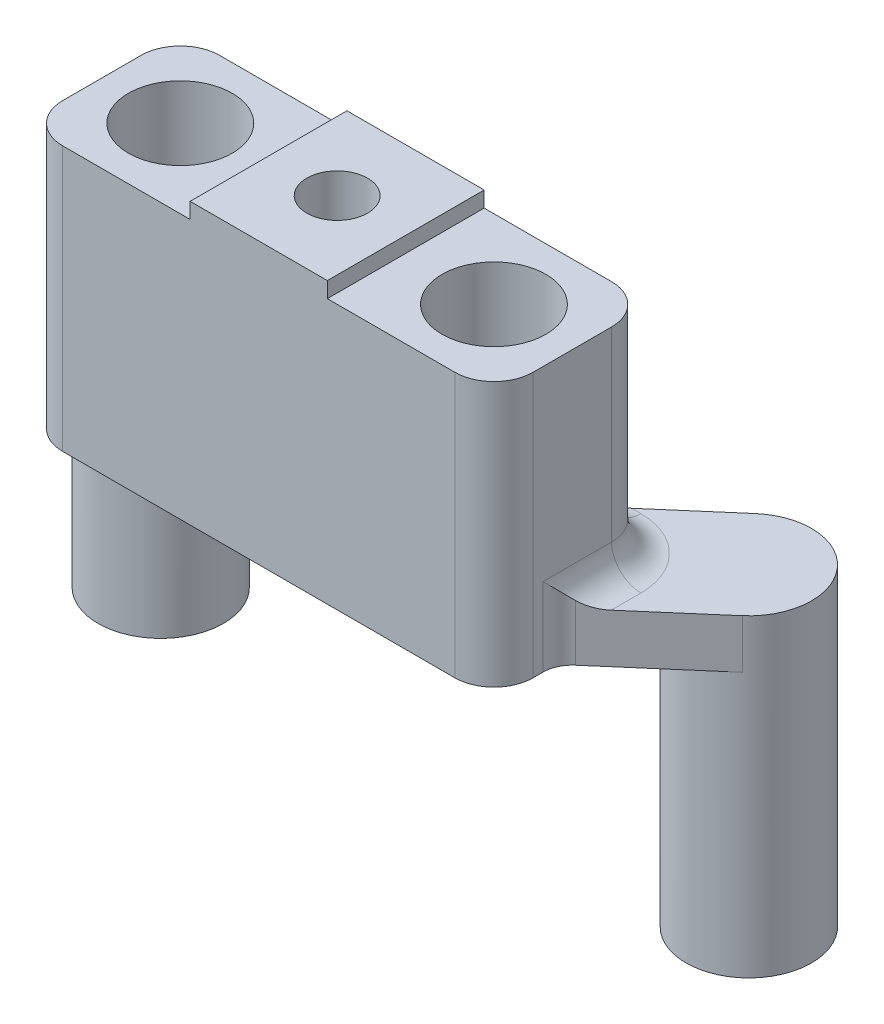
from build123d import *

# Parameters (mm, degrees)
SKETCH25_W               = 7
SKETCH25_H               = 8
BOSS_EXTRUDE5_DEPTH      = 12.8
BOSS_EXTRUDE6_DEPTH      = 12
BOSS_EXTRUDE6_DEPTH_BACK = 1.5
SKETCH26_W               = 24
SKETCH26_H               = 8
SKETCH26_R               = 2.65
SKETCH27_R               = 1.55
CUT_EXTRUDE1_DEPTH       = 6.5
FILLET1_R                = 2
BOSS_EXTRUDE8_DEPTH      = 2.5
FILLET2_R                = 1.5
BOSS_EXTRUDE9_START      = 13.5
SKETCH30_R               = 3.2
BOSS_EXTRUDE9_DEPTH      = 13.5
SKETCH31_R               = 2.25
CUT_EXTRUDE2_DEPTH       = 4


with BuildPart() as part:
    # Sketch25 → Boss-Extrude5 (new body)
    with BuildSketch(Plane(origin=(0, 0, 0), x_dir=(-1, 0, 0), z_dir=(0, 1, 0))):
        Rectangle(SKETCH25_W, SKETCH25_H)
    extrude(amount=BOSS_EXTRUDE5_DEPTH)

    # Sketch26 → Boss-Extrude6 (add, two sides: drawn at the far end of the back side and taken through both)
    with BuildSketch(Plane(origin=(0, 0, 0), x_dir=(-1, 0, 0), z_dir=(0, 1, 0)).offset(-BOSS_EXTRUDE6_DEPTH_BACK)):
        Rectangle(SKETCH26_W, SKETCH26_H)
        with Locations((-8, 0)):
            Circle(SKETCH26_R, mode=Mode.SUBTRACT)
        with Locations((8, 0)):
            Circle(SKETCH26_R, mode=Mode.SUBTRACT)
    extrude(amount=BOSS_EXTRUDE6_DEPTH + BOSS_EXTRUDE6_DEPTH_BACK)

    # Sketch27 → Cut-Extrude1 (cut)
    with BuildSketch(Plane(origin=(0, 12.8, 0), x_dir=(1, 0, 0), z_dir=(0, 1, 0))):
        Circle(SKETCH27_R)
    extrude(amount=-CUT_EXTRUDE1_DEPTH, mode=Mode.SUBTRACT)

    # Fillet1
    fillet1_edges = [part.edges().sort_by_distance(p)[0] for p in [
        (-12, 5.25, 4),
        (12, 5.25, 4),
        (-12, 5.25, -4),
        (12, 5.25, -4),
    ]]
    fillet(fillet1_edges, radius=FILLET1_R)

    # Sketch29 → Boss-Extrude8 (add)
    with BuildSketch(Plane.XZ.offset(1.5)):
        with BuildLine():
            Line((-17.090822427, -3.57750922), (-12, 0.816317906))
            Line((-12, 0.816317906), (-10.745987583, -2.422706372))
            Line((-10.745987583, -2.422706372), (-7.78514456, -4))
            Line((-7.78514456, -4), (-12.909177573, -8.42249078))
            ThreePointArc((-12.909177573, -8.42249078), (-17.42249078, -8.090822427), (-17.090822427, -3.57750922))
        make_face()
        with BuildLine():
            Line((17.090822427, -3.57750922), (12, 0.816317906))
            Line((12, 0.816317906), (10.79122124, -2.606916283))
            Line((10.79122124, -2.606916283), (7.78514456, -4))
            Line((7.78514456, -4), (12.909177573, -8.42249078))
            ThreePointArc((12.909177573, -8.42249078), (17.42249078, -8.090822427), (17.090822427, -3.57750922))
        make_face()
    extrude(amount=-BOSS_EXTRUDE8_DEPTH)

    # Fillet2
    fillet2_edges = [part.edges().sort_by_distance(p)[0] for p in [
        (12, 1, -0.591841047),
        (11.414213562, 1, -3.414213562),
        (-8.89257228, 1, -4),
        (-11.414213562, 1, -3.414213562),
        (-12, -0.25, 0.816317906),
        (12, -0.25, 0.816317906),
        (-7.78514456, -0.25, -4),
        (7.78514456, -0.25, -4),
        (8.89257228, 1, -4),
        (-12, 1, -0.591841047),
    ]]
    fillet(fillet2_edges, radius=FILLET2_R)

    # Sketch30 → Boss-Extrude9 (add)
    with BuildSketch(Plane.XZ.offset(1.5).offset(BOSS_EXTRUDE9_START)):
        with Locations((-15, -6)):
            Circle(SKETCH30_R)
        with Locations((15, -6)):
            Circle(SKETCH30_R)
    extrude(amount=-BOSS_EXTRUDE9_DEPTH)

    # Sketch31 → Cut-Extrude2 (cut)
    with BuildSketch(Plane.XZ.offset(15)):
        with Locations((-15, -6)):
            Circle(SKETCH31_R)
        with Locations((15, -6)):
            Circle(SKETCH31_R)
    extrude(amount=-CUT_EXTRUDE2_DEPTH, mode=Mode.SUBTRACT)


solid = part.part
